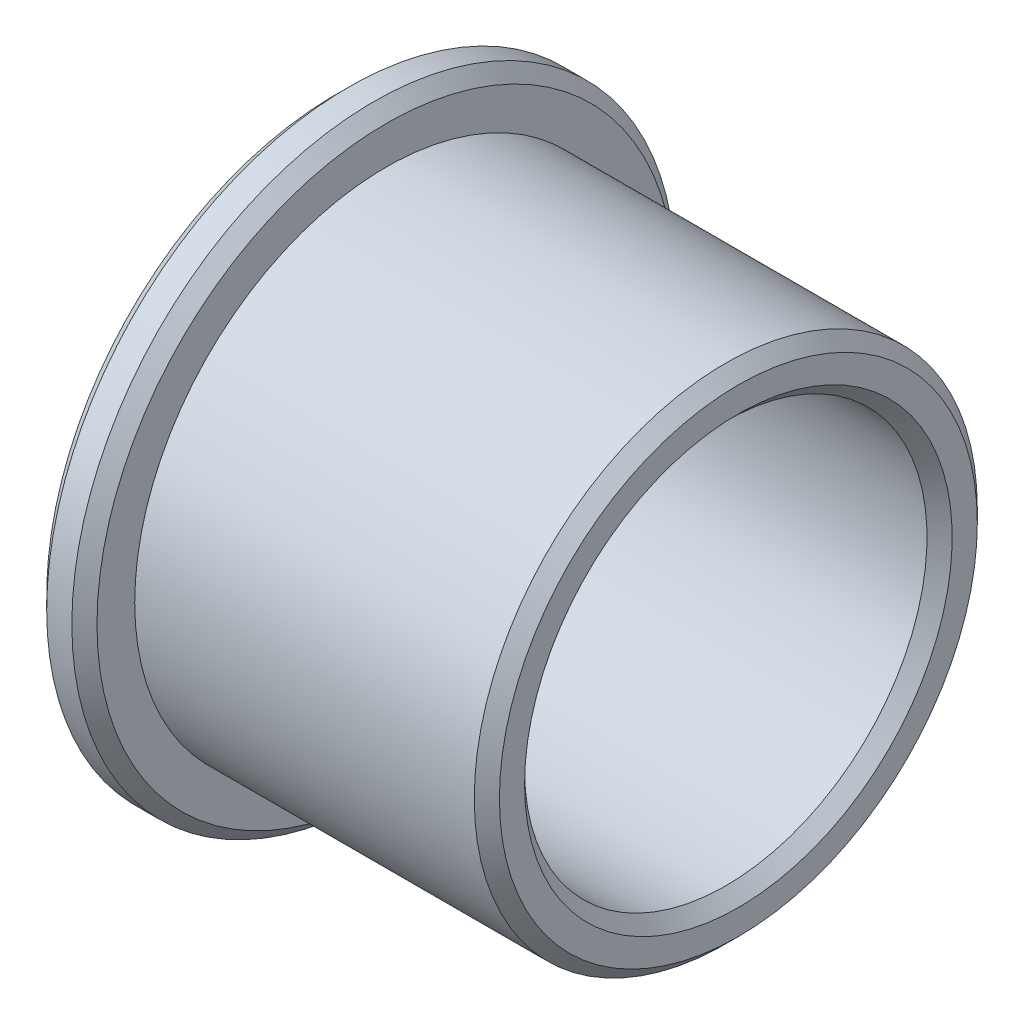
from build123d import *

# Parameters (mm, degrees)
CHANFREIN1_SIZE = 0.25


with BuildPart() as part:
    # Esquisse1 → Révolution1 (revolve)
    with BuildSketch(Plane(origin=(0, 0, 0), x_dir=(1, 0, 0), z_dir=(0, 1, 0)), mode=Mode.PRIVATE) as r_volution1_sk:
        Polygon((8, 5), (1, 5), (1, 6), (0, 6), (0, 4), (8, 4), align=None)
    revolve(r_volution1_sk.sketch.rotate(Axis((-2.315789474, 0, 0), (1, 0, 0)), 180), axis=Axis((-2.315789474, 0, 0), (1, 0, 0)))

    # Chanfrein1
    chanfrein1_edges = [part.edges().sort_by_distance(p)[0] for p in [
        (8, 0, -4),
        (0, 0, -4),
        (0, 0, -6),
        (1, 0, -6),
        (8, 0, -5),
    ]]
    chamfer(chanfrein1_edges, length=CHANFREIN1_SIZE)


solid = part.part
